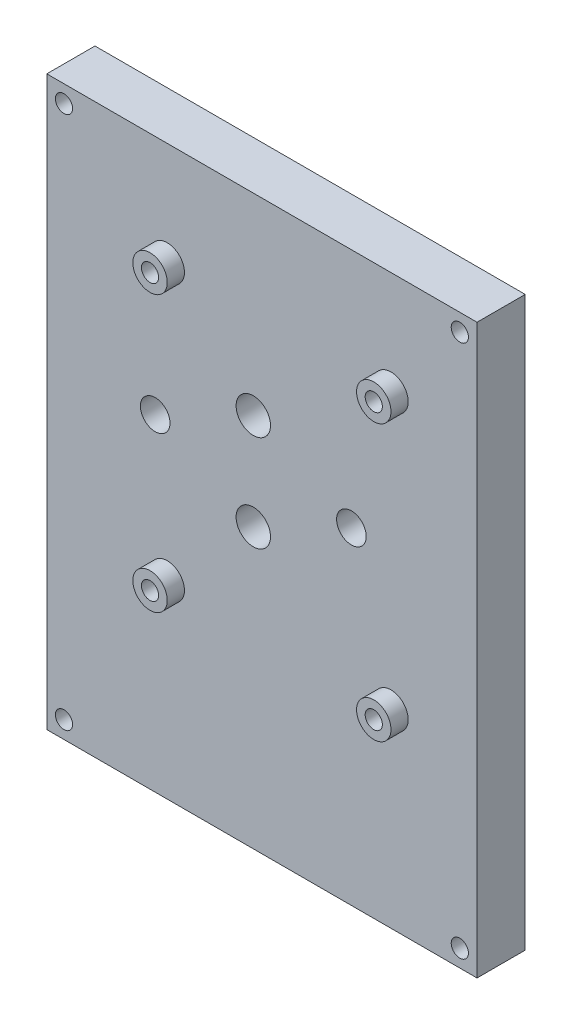
from build123d import *

# Parameters (mm, degrees)
SKIZZE1_R                         = 2.15
AUFSATZ_LINEAR_AUSTRAGEN1_DEPTH   = 12
AUFSATZ_LINEAR_AUSTRAGEN1_2_DEPTH = 12
AUFSATZ_LINEAR_START              = 7
SKIZZE1_3_W                       = 10
SKIZZE1_3_H                       = 34
SKIZZE1_3_R                       = 2.15
SKIZZE1_3_R_2                     = 2.5
AUFSATZ_LINEAR_AUSTRAGEN3_DEPTH   = 7
SKIZZE4_W                         = 52.5
SKIZZE4_H                         = 72.5
SKIZZE4_R                         = 2.5
SKIZZE4_R_2                       = 2.15
AUFSATZ_LINEAR_AUSTRAGEN4_DEPTH   = 7
SKIZZE4_3_R                       = 2.5
SKIZZE4_3_R_2                     = 1.25
AUFSATZ_LINEAR_AUSTRAGEN5_DEPTH   = 2.5
SCHNITT_LINEAR_START              = -7
SKIZZE4_4_R                       = 1.25
SCHNITT_LINEAR_AUSTRAGEN1_DEPTH   = 7
SKIZZE4_5_R                       = 2.15
SCHNITT_LINEAR_AUSTRAGEN2_DEPTH   = 19
SKIZZE6_W                         = 62.5
SKIZZE6_H                         = 82.5
SKIZZE6_W_2                       = 52.5
SKIZZE6_H_2                       = 72.5
AUFSATZ_LINEAR_AUSTRAGEN6_DEPTH   = 7
SKIZZE5_R                         = 1.25
SCHNITT_LINEAR_AUSTRAGEN3_DEPTH   = 7


with BuildPart() as part:
    # Skizze1 → Aufsatz-Linear austragen1 (new body)
    with BuildSketch(Plane.XY):
        with Locations((-14.25, 0)):
            Circle(SKIZZE1_R)
    extrude(amount=-AUFSATZ_LINEAR_AUSTRAGEN1_DEPTH)



with BuildPart() as body_2:
    # Skizze1 → Aufsatz-Linear austragen1 2 (new body)
    with BuildSketch(Plane.XY):
        with Locations((14.25, 0)):
            Circle(SKIZZE1_R)
    extrude(amount=-AUFSATZ_LINEAR_AUSTRAGEN1_2_DEPTH)


with BuildPart() as part_1:
    add(part.part)

    add(body_2.part)  # Aufsatz-Linear austragen3 merges body 2
    # Skizze1<3> → Aufsatz-Linear austragen3 (add)
    # profile 1 of 4: a face of its own
    with BuildSketch(Plane.XY.offset(AUFSATZ_LINEAR_START)):
        with Locations((-12.5, 0)):
            Rectangle(SKIZZE1_3_W, SKIZZE1_3_H)
        with Locations((-14.25, 0)):
            Circle(SKIZZE1_3_R, mode=Mode.SUBTRACT)
    # profile 2 of 4: a face of its own
    with BuildSketch(Plane.XY.offset(AUFSATZ_LINEAR_START)):
        Polygon((17.5, -17), (17.5, 17), (0, 17), (-7.5, 17), (-7.5, -17), align=None)
        with Locations((0, -7)):
            Circle(SKIZZE1_3_R_2, mode=Mode.SUBTRACT)
        with Locations((0, 7)):
            Circle(SKIZZE1_3_R_2, mode=Mode.SUBTRACT)
        with Locations((14.25, 0)):
            Circle(SKIZZE1_3_R, mode=Mode.SUBTRACT)
    # profile 3 of 4: a face of its own
    with BuildSketch(Plane.XY.offset(AUFSATZ_LINEAR_START)):
        with Locations((-14.25, 0)):
            Circle(SKIZZE1_3_R)
    # profile 4 of 4: a face of its own
    with BuildSketch(Plane.XY.offset(AUFSATZ_LINEAR_START)):
        with Locations((14.25, 0)):
            Circle(SKIZZE1_3_R)
    extrude(amount=-AUFSATZ_LINEAR_AUSTRAGEN3_DEPTH)

    # Skizze4 → Aufsatz-Linear austragen4 (add)
    with BuildSketch(Plane.XY.offset(7)):
        with Locations((1.25, -6.25)):
            Rectangle(SKIZZE4_W, SKIZZE4_H)
        with Locations((0, -7)):
            Circle(SKIZZE4_R, mode=Mode.SUBTRACT)
        with Locations((-14.25, 0)):
            Circle(SKIZZE4_R_2, mode=Mode.SUBTRACT)
        with Locations((0, 7)):
            Circle(SKIZZE4_R, mode=Mode.SUBTRACT)
        with Locations((14.25, 0)):
            Circle(SKIZZE4_R_2, mode=Mode.SUBTRACT)
    extrude(amount=-AUFSATZ_LINEAR_AUSTRAGEN4_DEPTH)

    # Skizze4<3> → Aufsatz-Linear austragen5 (add)
    # profile 1 of 4: a face of its own
    with BuildSketch(Plane.XY.offset(7)):
        with Locations((-12.5, -20)):
            Circle(SKIZZE4_3_R)
        with Locations((-12.5, -20)):
            Circle(SKIZZE4_3_R_2, mode=Mode.SUBTRACT)
    # profile 2 of 4: a face of its own
    with BuildSketch(Plane.XY.offset(7)):
        with Locations((-12.5, 20)):
            Circle(SKIZZE4_3_R)
        with Locations((-12.5, 20)):
            Circle(SKIZZE4_3_R_2, mode=Mode.SUBTRACT)
    # profile 3 of 4: a face of its own
    with BuildSketch(Plane.XY.offset(7)):
        with Locations((20, 20)):
            Circle(SKIZZE4_3_R)
        with Locations((20, 20)):
            Circle(SKIZZE4_3_R_2, mode=Mode.SUBTRACT)
    # profile 4 of 4: a face of its own
    with BuildSketch(Plane.XY.offset(7)):
        with Locations((20, -20)):
            Circle(SKIZZE4_3_R)
        with Locations((20, -20)):
            Circle(SKIZZE4_3_R_2, mode=Mode.SUBTRACT)
    extrude(amount=AUFSATZ_LINEAR_AUSTRAGEN5_DEPTH)

    # Skizze4<4> → Schnitt-Linear austragen1 (cut)
    with BuildSketch(Plane.XY.offset(7).offset(SCHNITT_LINEAR_START)):
        with Locations((-12.5, -20)):
            Circle(SKIZZE4_4_R)
        with Locations((20, 20)):
            Circle(SKIZZE4_4_R)
        with Locations((20, -20)):
            Circle(SKIZZE4_4_R)
        with Locations((-12.5, 20)):
            Circle(SKIZZE4_4_R)
    extrude(amount=SCHNITT_LINEAR_AUSTRAGEN1_DEPTH, mode=Mode.SUBTRACT)

    # Skizze4<5> → Schnitt-Linear austragen2 (cut)
    with BuildSketch(Plane.XY.offset(7)):
        with Locations((-14.25, 0)):
            Circle(SKIZZE4_5_R)
        with Locations((14.25, 0)):
            Circle(SKIZZE4_5_R)
    extrude(amount=-SCHNITT_LINEAR_AUSTRAGEN2_DEPTH, mode=Mode.SUBTRACT)

    # Skizze6 → Aufsatz-Linear austragen6 (add)
    with BuildSketch(Plane.XY.offset(7)):
        with Locations((1.25, -6.25)):
            Rectangle(SKIZZE6_W, SKIZZE6_H)
        with Locations((1.25, -6.25)):
            Rectangle(SKIZZE6_W_2, SKIZZE6_H_2, mode=Mode.SUBTRACT)
    extrude(amount=-AUFSATZ_LINEAR_AUSTRAGEN6_DEPTH)

    # Skizze5 → Schnitt-Linear austragen3 (cut)
    with BuildSketch(Plane.XY.offset(7)):
        with Locations((-27.5, 32.5)):
            Circle(SKIZZE5_R)
        with Locations((-27.5, -45)):
            Circle(SKIZZE5_R)
        with Locations((30, -45)):
            Circle(SKIZZE5_R)
        with Locations((30, 32.5)):
            Circle(SKIZZE5_R)
    extrude(amount=-SCHNITT_LINEAR_AUSTRAGEN3_DEPTH, mode=Mode.SUBTRACT)


solid = part_1.part
